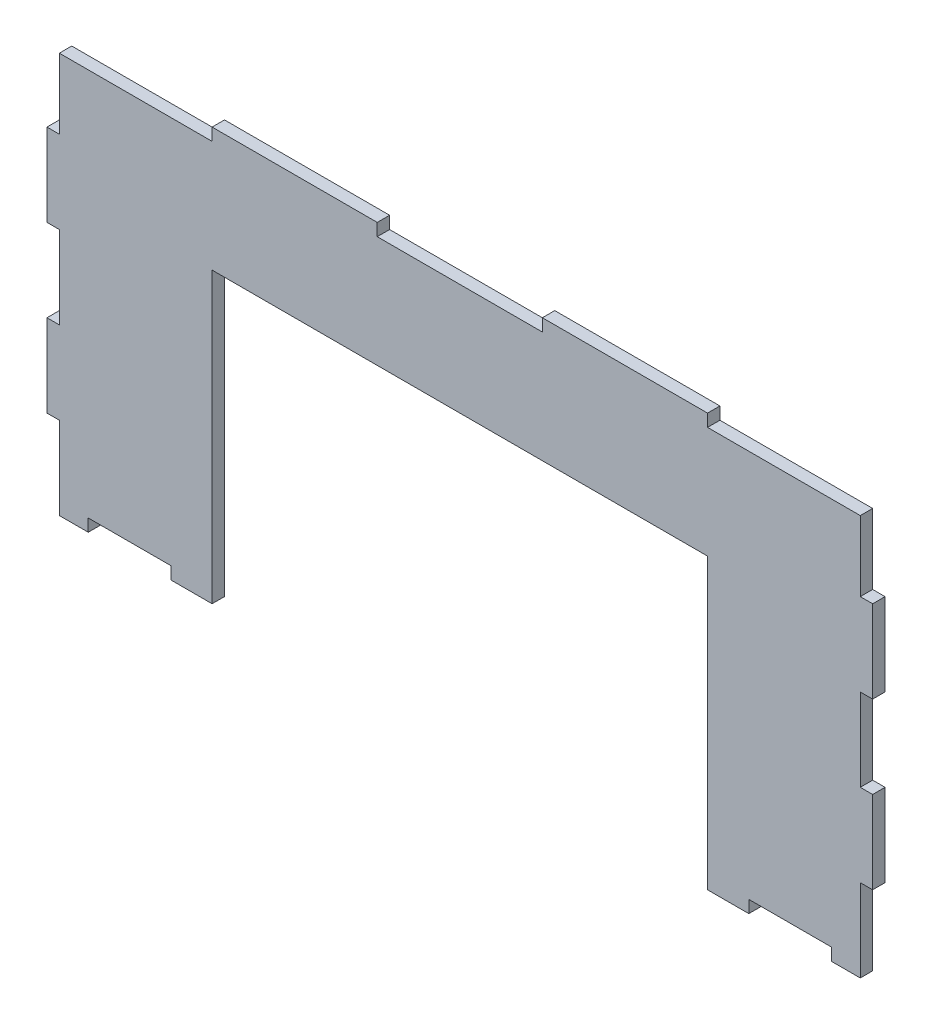
from build123d import *

# Parameters (mm, degrees)
BOSS_EXTRUDE1_DEPTH = 3
SKETCH2_W           = 3
SKETCH2_H           = 20
SKETCH2_W_2         = 40
SKETCH2_H_2         = 3
CUT_EXTRUDE2_DEPTH  = 3


with BuildPart() as part:
    # Sketch1 → Boss-Extrude1 (new body)
    with BuildSketch(Plane.XY):
        Polygon((-60, 5.09773753), (-60, -50), (-70, -50), (-70, -47), (-90, -47), (-90, -50), (-100, -50), (-100, 50), (100, 50), (100, -50), (90, -50), (90, -47), (70, -47), (70, -50), (60, -50), (60, -40.178411678), (60, 20), (-60, 20), align=None)
    extrude(amount=BOSS_EXTRUDE1_DEPTH)

    # Sketch2 → Cut-Extrude2 (cut)
    with BuildSketch(Plane.XY.offset(3)):
        Polygon((-100, 47), (-100, 30), (-97, 30), (-97, 47), (-60, 47), (-60, 50), (-100, 50), align=None)
        with Locations((-98.5, 0)):
            Rectangle(SKETCH2_W, SKETCH2_H)
        with Locations((-98.5, -40)):
            Rectangle(SKETCH2_W, SKETCH2_H)
        with Locations((0, 48.5)):
            Rectangle(SKETCH2_W_2, SKETCH2_H_2)
        Polygon((100, 50), (60, 50), (60, 47), (97, 47), (97, 30), (100, 30), (100, 47), align=None)
        with Locations((98.5, 0)):
            Rectangle(SKETCH2_W, SKETCH2_H)
        with Locations((98.5, -40)):
            Rectangle(SKETCH2_W, SKETCH2_H)
    extrude(amount=-CUT_EXTRUDE2_DEPTH, mode=Mode.SUBTRACT)


solid = part.part
